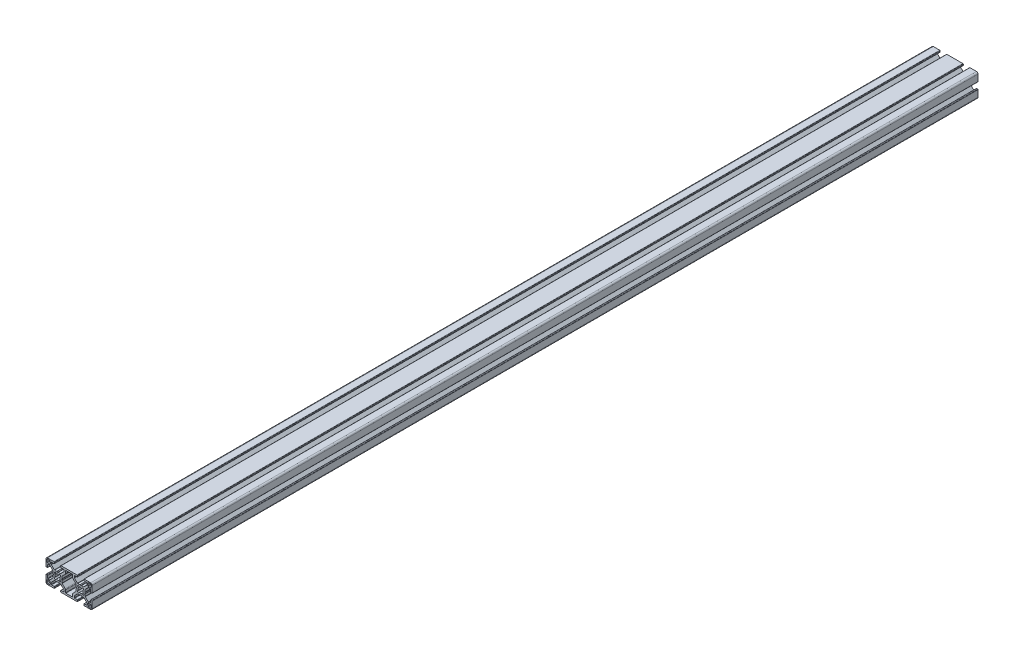
from build123d import *

# Parameters (mm, degrees)
EXTRUDE1_DEPTH     = 1150
SKETCH2_R          = 3.175
CUT_EXTRUDE1_DEPTH = 1151.782342583


with BuildPart() as part:
    # Sketch1 → Extrude1 (new body)
    with BuildSketch(Plane.XY):
        with BuildLine():
            Line((-10.428, -15), (10.428, -15))
            ThreePointArc((10.428, -15), (10.787210245, -14.851210245), (10.936, -14.492))
            Line((10.936, -14.492), (10.936, -13.2982))
            ThreePointArc((10.936, -13.2982), (10.787210245, -12.938989755), (10.428, -12.7902))
            Line((10.428, -12.7902), (7.253, -12.7902))
            ThreePointArc((7.253, -12.7902), (6.893789755, -12.641410245), (6.745, -12.2822))
            Line((6.745, -12.2822), (6.745, -10.261471714))
            ThreePointArc((6.745, -10.261471714), (6.783669197, -10.06706853), (6.893789755, -9.902261469))
            Line((6.893789755, -9.902261469), (10.825246067, -5.970805157))
            ThreePointArc((10.825246067, -5.970805157), (10.990053129, -5.860684599), (11.184456312, -5.822015402))
            Line((11.184456312, -5.822015402), (14.0475, -5.822015402))
            Line((14.0475, -5.822015402), (15, -5.314015402))
            Line((15, -5.314015402), (15.9525, -5.822015402))
            Line((15.9525, -5.822015402), (18.815543688, -5.822015402))
            ThreePointArc((18.815543688, -5.822015402), (19.009946871, -5.860684599), (19.174753933, -5.970805157))
            Line((19.174753933, -5.970805157), (23.106210245, -9.902261469))
            ThreePointArc((23.106210245, -9.902261469), (23.216330803, -10.06706853), (23.255, -10.261471714))
            Line((23.255, -10.261471714), (23.255, -12.2822))
            ThreePointArc((23.255, -12.2822), (23.106210245, -12.641410245), (22.747, -12.7902))
            Line((22.747, -12.7902), (19.572, -12.7902))
            ThreePointArc((19.572, -12.7902), (19.212789755, -12.938989755), (19.064, -13.2982))
            Line((19.064, -13.2982), (19.064, -14.492))
            ThreePointArc((19.064, -14.492), (19.212789755, -14.851210245), (19.572, -15))
            Line((19.572, -15), (27.9934, -15))
            ThreePointArc((27.9934, -15), (29.412280467, -14.412280467), (30, -12.9934))
            Line((30, -12.9934), (30, -4.572))
            ThreePointArc((30, -4.572), (29.851210245, -4.212789755), (29.492, -4.064))
            Line((29.492, -4.064), (28.2982, -4.064))
            ThreePointArc((28.2982, -4.064), (27.938989755, -4.212789755), (27.7902, -4.572))
            Line((27.7902, -4.572), (27.7902, -7.747))
            ThreePointArc((27.7902, -7.747), (27.641410245, -8.106210245), (27.2822, -8.255))
            Line((27.2822, -8.255), (25.261471714, -8.255))
            ThreePointArc((25.261471714, -8.255), (25.06706853, -8.216330803), (24.902261469, -8.106210245))
            Line((24.902261469, -8.106210245), (20.970805157, -4.174753933))
            ThreePointArc((20.970805157, -4.174753933), (20.860684599, -4.009946871), (20.822015402, -3.815543688))
            Line((20.822015402, -3.815543688), (20.822015402, -0.9525))
            Line((20.822015402, -0.9525), (20.314015402, 0))
            Line((20.314015402, 0), (20.822015402, 0.9525))
            Line((20.822015402, 0.9525), (20.822015402, 3.815543688))
            ThreePointArc((20.822015402, 3.815543688), (20.860684599, 4.009946871), (20.970805157, 4.174753933))
            Line((20.970805157, 4.174753933), (24.902261469, 8.106210245))
            ThreePointArc((24.902261469, 8.106210245), (25.06706853, 8.216330803), (25.261471714, 8.255))
            Line((25.261471714, 8.255), (27.2822, 8.255))
            ThreePointArc((27.2822, 8.255), (27.641410245, 8.106210245), (27.7902, 7.747))
            Line((27.7902, 7.747), (27.7902, 4.572))
            ThreePointArc((27.7902, 4.572), (27.938989755, 4.212789755), (28.2982, 4.064))
            Line((28.2982, 4.064), (29.492, 4.064))
            ThreePointArc((29.492, 4.064), (29.851210245, 4.212789755), (30, 4.572))
            Line((30, 4.572), (30, 12.9934))
            ThreePointArc((30, 12.9934), (29.412280467, 14.412280467), (27.9934, 15))
            Line((27.9934, 15), (19.572, 15))
            ThreePointArc((19.572, 15), (19.212789755, 14.851210245), (19.064, 14.492))
            Line((19.064, 14.492), (19.064, 13.2982))
            ThreePointArc((19.064, 13.2982), (19.212789755, 12.938989755), (19.572, 12.7902))
            Line((19.572, 12.7902), (22.747, 12.7902))
            ThreePointArc((22.747, 12.7902), (23.106210245, 12.641410245), (23.255, 12.2822))
            Line((23.255, 12.2822), (23.255, 10.261471714))
            ThreePointArc((23.255, 10.261471714), (23.216330803, 10.06706853), (23.106210245, 9.902261469))
            Line((23.106210245, 9.902261469), (19.174753933, 5.970805157))
            ThreePointArc((19.174753933, 5.970805157), (19.009946871, 5.860684599), (18.815543688, 5.822015402))
            Line((18.815543688, 5.822015402), (15.9525, 5.822015402))
            Line((15.9525, 5.822015402), (15, 5.314015402))
            Line((15, 5.314015402), (14.0475, 5.822015402))
            Line((14.0475, 5.822015402), (11.184456312, 5.822015402))
            ThreePointArc((11.184456312, 5.822015402), (10.990053129, 5.860684599), (10.825246067, 5.970805157))
            Line((10.825246067, 5.970805157), (6.893789755, 9.902261469))
            ThreePointArc((6.893789755, 9.902261469), (6.783669197, 10.06706853), (6.745, 10.261471714))
            Line((6.745, 10.261471714), (6.745, 12.2822))
            ThreePointArc((6.745, 12.2822), (6.893789755, 12.641410245), (7.253, 12.7902))
            Line((7.253, 12.7902), (10.428, 12.7902))
            ThreePointArc((10.428, 12.7902), (10.787210245, 12.938989755), (10.936, 13.2982))
            Line((10.936, 13.2982), (10.936, 14.492))
            ThreePointArc((10.936, 14.492), (10.787210245, 14.851210245), (10.428, 15))
            Line((10.428, 15), (-10.428, 15))
            ThreePointArc((-10.428, 15), (-10.787210245, 14.851210245), (-10.936, 14.492))
            Line((-10.936, 14.492), (-10.936, 13.2982))
            ThreePointArc((-10.936, 13.2982), (-10.787210245, 12.938989755), (-10.428, 12.7902))
            Line((-10.428, 12.7902), (-7.253, 12.7902))
            ThreePointArc((-7.253, 12.7902), (-6.893789755, 12.641410245), (-6.745, 12.2822))
            Line((-6.745, 12.2822), (-6.745, 10.261471714))
            ThreePointArc((-6.745, 10.261471714), (-6.783669197, 10.06706853), (-6.893789755, 9.902261469))
            Line((-6.893789755, 9.902261469), (-10.825246067, 5.970805157))
            ThreePointArc((-10.825246067, 5.970805157), (-10.990053129, 5.860684599), (-11.184456312, 5.822015402))
            Line((-11.184456312, 5.822015402), (-14.0475, 5.822015402))
            Line((-14.0475, 5.822015402), (-15, 5.314015402))
            Line((-15, 5.314015402), (-15.9525, 5.822015402))
            Line((-15.9525, 5.822015402), (-18.815543688, 5.822015402))
            ThreePointArc((-18.815543688, 5.822015402), (-19.009946871, 5.860684599), (-19.174753933, 5.970805157))
            Line((-19.174753933, 5.970805157), (-23.106210245, 9.902261469))
            ThreePointArc((-23.106210245, 9.902261469), (-23.216330803, 10.06706853), (-23.255, 10.261471714))
            Line((-23.255, 10.261471714), (-23.255, 12.2822))
            ThreePointArc((-23.255, 12.2822), (-23.106210245, 12.641410245), (-22.747, 12.7902))
            Line((-22.747, 12.7902), (-19.572, 12.7902))
            ThreePointArc((-19.572, 12.7902), (-19.212789755, 12.938989755), (-19.064, 13.2982))
            Line((-19.064, 13.2982), (-19.064, 14.492))
            ThreePointArc((-19.064, 14.492), (-19.212789755, 14.851210245), (-19.572, 15))
            Line((-19.572, 15), (-27.9934, 15))
            ThreePointArc((-27.9934, 15), (-29.412280467, 14.412280467), (-30, 12.9934))
            Line((-30, 12.9934), (-30, 4.572))
            ThreePointArc((-30, 4.572), (-29.851210245, 4.212789755), (-29.492, 4.064))
            Line((-29.492, 4.064), (-28.2982, 4.064))
            ThreePointArc((-28.2982, 4.064), (-27.938989755, 4.212789755), (-27.7902, 4.572))
            Line((-27.7902, 4.572), (-27.7902, 7.747))
            ThreePointArc((-27.7902, 7.747), (-27.641410245, 8.106210245), (-27.2822, 8.255))
            Line((-27.2822, 8.255), (-25.261471714, 8.255))
            ThreePointArc((-25.261471714, 8.255), (-25.06706853, 8.216330803), (-24.902261469, 8.106210245))
            Line((-24.902261469, 8.106210245), (-20.970805157, 4.174753933))
            ThreePointArc((-20.970805157, 4.174753933), (-20.860684599, 4.009946871), (-20.822015402, 3.815543688))
            Line((-20.822015402, 3.815543688), (-20.822015402, 0.9525))
            Line((-20.822015402, 0.9525), (-20.314015402, 0))
            Line((-20.314015402, 0), (-20.822015402, -0.9525))
            Line((-20.822015402, -0.9525), (-20.822015402, -3.815543688))
            ThreePointArc((-20.822015402, -3.815543688), (-20.860684599, -4.009946871), (-20.970805157, -4.174753933))
            Line((-20.970805157, -4.174753933), (-24.902261469, -8.106210245))
            ThreePointArc((-24.902261469, -8.106210245), (-25.06706853, -8.216330803), (-25.261471714, -8.255))
            Line((-25.261471714, -8.255), (-27.2822, -8.255))
            ThreePointArc((-27.2822, -8.255), (-27.641410245, -8.106210245), (-27.7902, -7.747))
            Line((-27.7902, -7.747), (-27.7902, -4.572))
            ThreePointArc((-27.7902, -4.572), (-27.938989755, -4.212789755), (-28.2982, -4.064))
            Line((-28.2982, -4.064), (-29.492, -4.064))
            ThreePointArc((-29.492, -4.064), (-29.851210245, -4.212789755), (-30, -4.572))
            Line((-30, -4.572), (-30, -12.9934))
            ThreePointArc((-30, -12.9934), (-29.412280467, -14.412280467), (-27.9934, -15))
            Line((-27.9934, -15), (-19.572, -15))
            ThreePointArc((-19.572, -15), (-19.212789755, -14.851210245), (-19.064, -14.492))
            Line((-19.064, -14.492), (-19.064, -13.2982))
            ThreePointArc((-19.064, -13.2982), (-19.212789755, -12.938989755), (-19.572, -12.7902))
            Line((-19.572, -12.7902), (-22.747, -12.7902))
            ThreePointArc((-22.747, -12.7902), (-23.106210245, -12.641410245), (-23.255, -12.2822))
            Line((-23.255, -12.2822), (-23.255, -10.261471714))
            ThreePointArc((-23.255, -10.261471714), (-23.216330803, -10.06706853), (-23.106210245, -9.902261469))
            Line((-23.106210245, -9.902261469), (-19.174753933, -5.970805157))
            ThreePointArc((-19.174753933, -5.970805157), (-19.009946871, -5.860684599), (-18.815543688, -5.822015402))
            Line((-18.815543688, -5.822015402), (-15.9525, -5.822015402))
            Line((-15.9525, -5.822015402), (-15, -5.314015402))
            Line((-15, -5.314015402), (-14.0475, -5.822015402))
            Line((-14.0475, -5.822015402), (-11.184456312, -5.822015402))
            ThreePointArc((-11.184456312, -5.822015402), (-10.990053129, -5.860684599), (-10.825246067, -5.970805157))
            Line((-10.825246067, -5.970805157), (-6.893789755, -9.902261469))
            ThreePointArc((-6.893789755, -9.902261469), (-6.783669197, -10.06706853), (-6.745, -10.261471714))
            Line((-6.745, -10.261471714), (-6.745, -12.2822))
            ThreePointArc((-6.745, -12.2822), (-6.893789755, -12.641410245), (-7.253, -12.7902))
            Line((-7.253, -12.7902), (-10.428, -12.7902))
            ThreePointArc((-10.428, -12.7902), (-10.787210245, -12.938989755), (-10.936, -13.2982))
            Line((-10.936, -13.2982), (-10.936, -14.492))
            ThreePointArc((-10.936, -14.492), (-10.787210245, -14.851210245), (-10.428, -15))
        make_face()
        with BuildLine():
            Line((12.782541514, 3.726141514), (13.525717665, 2.982965363))
            ThreePointArc((13.525717665, 2.982965363), (15, 3.3274), (16.474282335, 2.982965363))
            Line((16.474282335, 2.982965363), (17.217458486, 3.726141514))
            ThreePointArc((17.217458486, 3.726141514), (18.726141514, 3.726141514), (18.726141514, 2.217458486))
            Line((18.726141514, 2.217458486), (17.982965363, 1.474282335))
            ThreePointArc((17.982965363, 1.474282335), (18.3274, 0), (17.982965363, -1.474282335))
            Line((17.982965363, -1.474282335), (18.726141514, -2.217458486))
            ThreePointArc((18.726141514, -2.217458486), (18.726141514, -3.726141514), (17.217458486, -3.726141514))
            Line((17.217458486, -3.726141514), (16.474282335, -2.982965363))
            ThreePointArc((16.474282335, -2.982965363), (15, -3.3274), (13.525717665, -2.982965363))
            Line((13.525717665, -2.982965363), (12.782541514, -3.726141514))
            ThreePointArc((12.782541514, -3.726141514), (11.273858486, -3.726141514), (11.273858486, -2.217458486))
            Line((11.273858486, -2.217458486), (12.017034637, -1.474282335))
            ThreePointArc((12.017034637, -1.474282335), (11.6726, 0), (12.017034637, 1.474282335))
            Line((12.017034637, 1.474282335), (11.273858486, 2.217458486))
            ThreePointArc((11.273858486, 2.217458486), (11.273858486, 3.726141514), (12.782541514, 3.726141514))
        make_face(mode=Mode.SUBTRACT)
        with BuildLine():
            Line((-28.7046, 9.8946), (-28.7046, 12.6886))
            ThreePointArc((-28.7046, 12.6886), (-28.40702049, 13.40702049), (-27.6886, 13.7046))
            Line((-27.6886, 13.7046), (-24.8946, 13.7046))
            ThreePointArc((-24.8946, 13.7046), (-24.625192316, 13.593007684), (-24.5136, 13.3236))
            Line((-24.5136, 13.3236), (-24.5136, 9.8946))
            ThreePointArc((-24.5136, 9.8946), (-24.625192316, 9.625192316), (-24.8946, 9.5136))
            Line((-24.8946, 9.5136), (-28.3236, 9.5136))
            ThreePointArc((-28.3236, 9.5136), (-28.593007684, 9.625192316), (-28.7046, 9.8946))
        make_face(mode=Mode.SUBTRACT)
        with BuildLine():
            Line((-24.8946, -13.7046), (-27.6886, -13.7046))
            ThreePointArc((-27.6886, -13.7046), (-28.40702049, -13.40702049), (-28.7046, -12.6886))
            Line((-28.7046, -12.6886), (-28.7046, -9.8946))
            ThreePointArc((-28.7046, -9.8946), (-28.593007684, -9.625192316), (-28.3236, -9.5136))
            Line((-28.3236, -9.5136), (-24.8946, -9.5136))
            ThreePointArc((-24.8946, -9.5136), (-24.625192316, -9.625192316), (-24.5136, -9.8946))
            Line((-24.5136, -9.8946), (-24.5136, -13.3236))
            ThreePointArc((-24.5136, -13.3236), (-24.625192316, -13.593007684), (-24.8946, -13.7046))
        make_face(mode=Mode.SUBTRACT)
        with BuildLine():
            Line((4.981569265, 8.22237951), (9.029194843, 4.174753933))
            ThreePointArc((9.029194843, 4.174753933), (9.139315401, 4.009946871), (9.177984598, 3.815543688))
            Line((9.177984598, 3.815543688), (9.177984598, 0.9525))
            Line((9.177984598, 0.9525), (9.685984598, 0))
            Line((9.685984598, 0), (9.177984598, -0.9525))
            Line((9.177984598, -0.9525), (9.177984598, -3.815543688))
            ThreePointArc((9.177984598, -3.815543688), (9.139315401, -4.009946871), (9.029194843, -4.174753933))
            Line((9.029194843, -4.174753933), (4.981569265, -8.22237951))
            ThreePointArc((4.981569265, -8.22237951), (4.651207592, -8.716800694), (4.5352, -9.300010245))
            Line((4.5352, -9.300010245), (4.5352, -12.4092))
            ThreePointArc((4.5352, -12.4092), (4.423607684, -12.678607684), (4.1542, -12.7902))
            Line((4.1542, -12.7902), (-4.1542, -12.7902))
            ThreePointArc((-4.1542, -12.7902), (-4.423607684, -12.678607684), (-4.5352, -12.4092))
            Line((-4.5352, -12.4092), (-4.5352, -9.300010245))
            ThreePointArc((-4.5352, -9.300010245), (-4.651207592, -8.716800694), (-4.981569265, -8.22237951))
            Line((-4.981569265, -8.22237951), (-9.029194843, -4.174753933))
            ThreePointArc((-9.029194843, -4.174753933), (-9.139315401, -4.009946871), (-9.177984598, -3.815543688))
            Line((-9.177984598, -3.815543688), (-9.177984598, -0.9525))
            Line((-9.177984598, -0.9525), (-9.685984598, 0))
            Line((-9.685984598, 0), (-9.177984598, 0.9525))
            Line((-9.177984598, 0.9525), (-9.177984598, 3.815543688))
            ThreePointArc((-9.177984598, 3.815543688), (-9.139315401, 4.009946871), (-9.029194843, 4.174753933))
            Line((-9.029194843, 4.174753933), (-4.981569265, 8.22237951))
            ThreePointArc((-4.981569265, 8.22237951), (-4.651207592, 8.716800694), (-4.5352, 9.300010245))
            Line((-4.5352, 9.300010245), (-4.5352, 12.4092))
            ThreePointArc((-4.5352, 12.4092), (-4.423607684, 12.678607684), (-4.1542, 12.7902))
            Line((-4.1542, 12.7902), (4.1542, 12.7902))
            ThreePointArc((4.1542, 12.7902), (4.423607684, 12.678607684), (4.5352, 12.4092))
            Line((4.5352, 12.4092), (4.5352, 9.300010245))
            ThreePointArc((4.5352, 9.300010245), (4.651207592, 8.716800694), (4.981569265, 8.22237951))
        make_face(mode=Mode.SUBTRACT)
        with BuildLine():
            Line((-18.726141514, -2.217458486), (-17.982965363, -1.474282335))
            ThreePointArc((-17.982965363, -1.474282335), (-18.3274, 0), (-17.982965363, 1.474282335))
            Line((-17.982965363, 1.474282335), (-18.726141514, 2.217458486))
            ThreePointArc((-18.726141514, 2.217458486), (-18.726141514, 3.726141514), (-17.217458486, 3.726141514))
            Line((-17.217458486, 3.726141514), (-16.474282335, 2.982965363))
            ThreePointArc((-16.474282335, 2.982965363), (-15, 3.3274), (-13.525717665, 2.982965363))
            Line((-13.525717665, 2.982965363), (-12.782541514, 3.726141514))
            ThreePointArc((-12.782541514, 3.726141514), (-11.273858486, 3.726141514), (-11.273858486, 2.217458486))
            Line((-11.273858486, 2.217458486), (-12.017034637, 1.474282335))
            ThreePointArc((-12.017034637, 1.474282335), (-11.6726, 0), (-12.017034637, -1.474282335))
            Line((-12.017034637, -1.474282335), (-11.273858486, -2.217458486))
            ThreePointArc((-11.273858486, -2.217458486), (-11.273858486, -3.726141514), (-12.782541514, -3.726141514))
            Line((-12.782541514, -3.726141514), (-13.525717665, -2.982965363))
            ThreePointArc((-13.525717665, -2.982965363), (-15, -3.3274), (-16.474282335, -2.982965363))
            Line((-16.474282335, -2.982965363), (-17.217458486, -3.726141514))
            ThreePointArc((-17.217458486, -3.726141514), (-18.726141514, -3.726141514), (-18.726141514, -2.217458486))
        make_face(mode=Mode.SUBTRACT)
        with BuildLine():
            Line((24.8946, 13.7046), (27.6886, 13.7046))
            ThreePointArc((27.6886, 13.7046), (28.40702049, 13.40702049), (28.7046, 12.6886))
            Line((28.7046, 12.6886), (28.7046, 9.8946))
            ThreePointArc((28.7046, 9.8946), (28.593007684, 9.625192316), (28.3236, 9.5136))
            Line((28.3236, 9.5136), (24.8946, 9.5136))
            ThreePointArc((24.8946, 9.5136), (24.625192316, 9.625192316), (24.5136, 9.8946))
            Line((24.5136, 9.8946), (24.5136, 13.3236))
            ThreePointArc((24.5136, 13.3236), (24.625192316, 13.593007684), (24.8946, 13.7046))
        make_face(mode=Mode.SUBTRACT)
        with BuildLine():
            Line((24.5136, -13.3236), (24.5136, -9.8946))
            ThreePointArc((24.5136, -9.8946), (24.625192316, -9.625192316), (24.8946, -9.5136))
            Line((24.8946, -9.5136), (28.3236, -9.5136))
            ThreePointArc((28.3236, -9.5136), (28.593007684, -9.625192316), (28.7046, -9.8946))
            Line((28.7046, -9.8946), (28.7046, -12.6886))
            ThreePointArc((28.7046, -12.6886), (28.40702049, -13.40702049), (27.6886, -13.7046))
            Line((27.6886, -13.7046), (24.8946, -13.7046))
            ThreePointArc((24.8946, -13.7046), (24.625192316, -13.593007684), (24.5136, -13.3236))
        make_face(mode=Mode.SUBTRACT)
    extrude(amount=-EXTRUDE1_DEPTH)

    # Sketch2 → Cut-Extrude1 (cut, through all)
    with BuildSketch(Plane(origin=(0, 15, 0), x_dir=(1, 0, 0), z_dir=(0, 1, 0))):
        with Locations(Location((15, 781, 0), (0, 0, 134.299825788))):
            Circle(SKETCH2_R)
        with Locations(Location((15, 369, 0), (0, 0, 134.299825788))):
            Circle(SKETCH2_R)
    extrude(amount=-CUT_EXTRUDE1_DEPTH, mode=Mode.SUBTRACT)


solid = part.part
